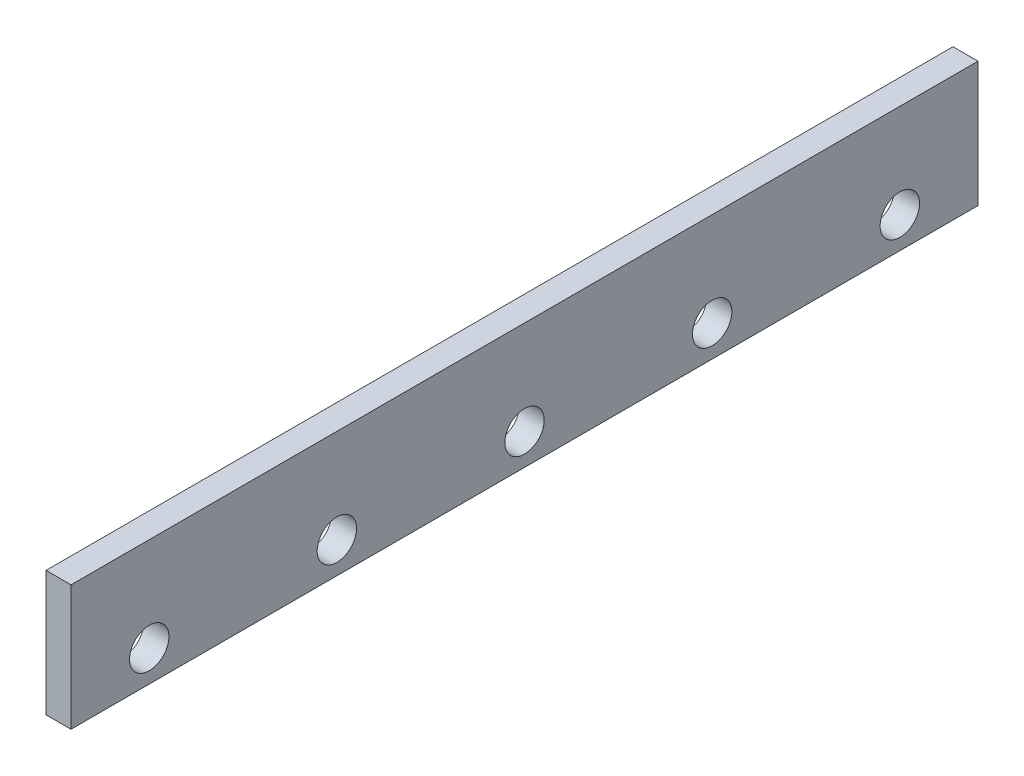
from build123d import *

# Parameters (mm, degrees)
SKETCH1_W           = 580
SKETCH1_H           = 80
SKETCH1_R           = 12.6
BOSS_EXTRUDE1_DEPTH = 8


with BuildPart() as part:
    # Sketch1 → Boss-Extrude1 (new, symmetric)
    with BuildSketch(Plane(origin=(0, 0, 0), x_dir=(0, 0, -1), z_dir=(1, 0, 0))):
        Rectangle(SKETCH1_W, SKETCH1_H)
        with Locations((-240, -20)):
            Circle(SKETCH1_R, mode=Mode.SUBTRACT)
        with Locations((-120, -20)):
            Circle(SKETCH1_R, mode=Mode.SUBTRACT)
        with Locations((0, -20)):
            Circle(SKETCH1_R, mode=Mode.SUBTRACT)
        with Locations((120, -20)):
            Circle(SKETCH1_R, mode=Mode.SUBTRACT)
        with Locations((240, -20)):
            Circle(SKETCH1_R, mode=Mode.SUBTRACT)
    extrude(amount=BOSS_EXTRUDE1_DEPTH, both=True)


solid = part.part
